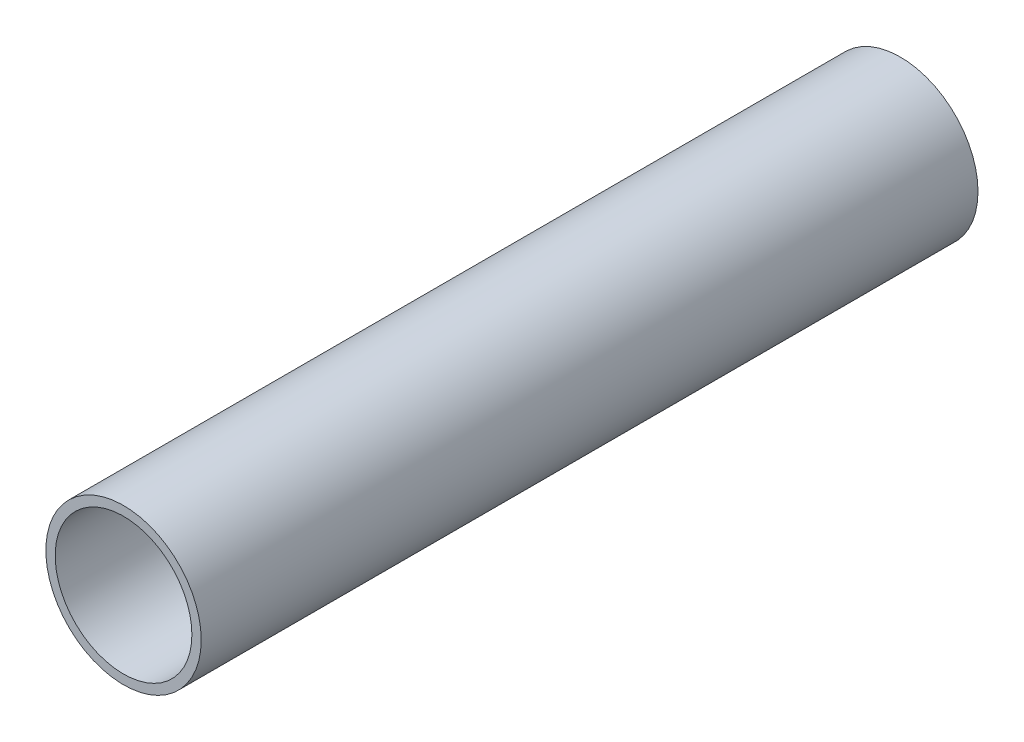
from build123d import *

# Parameters (mm, degrees)
SKETCH1_R           = 2.5
SKETCH1_R_2         = 2.2
BOSS_EXTRUDE1_DEPTH = 25


with BuildPart() as part:
    # Sketch1 → Boss-Extrude1 (new body)
    with BuildSketch(Plane.XY):
        Circle(SKETCH1_R)
        Circle(SKETCH1_R_2, mode=Mode.SUBTRACT)
    extrude(amount=BOSS_EXTRUDE1_DEPTH)


solid = part.part
